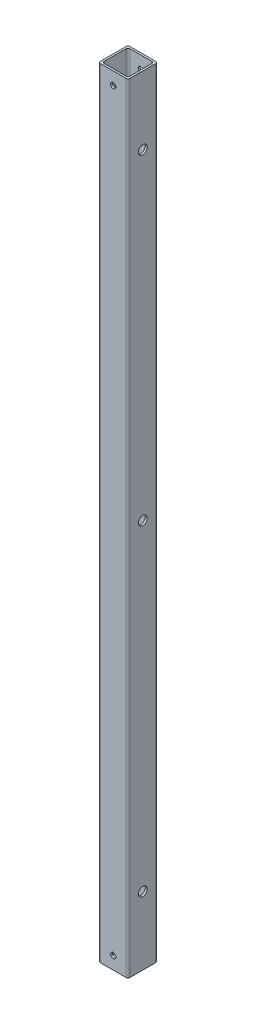
from build123d import *

# Parameters (mm, degrees)
SKETCH1_W                  = 19.304
SKETCH1_H                  = 19.304
SKETCH1_W_2                = 16.764
SKETCH1_H_2                = 16.764
BOSS_EXTRUDE1_DEPTH        = 508
FILLET1_R                  = 1.27
F_1_0_228_DIAMETER_HOLE2_D = 5.7912
F_8_32_TAPPED_HOLE1_D      = 3.4544


with BuildPart() as part:
    # Sketch1 → Boss-Extrude1 (new body)
    with BuildSketch(Plane(origin=(0, 0, 0), x_dir=(1, 0, 0), z_dir=(0, 1, 0))):
        Rectangle(SKETCH1_W, SKETCH1_H)
        Rectangle(SKETCH1_W_2, SKETCH1_H_2, mode=Mode.SUBTRACT)
    extrude(amount=BOSS_EXTRUDE1_DEPTH)

    # Fillet1
    fillet1_edges = [part.edges().sort_by_distance(p)[0] for p in [
        (-8.382, 254, 8.382),
        (8.382, 254, 8.382),
        (8.382, 254, -8.382),
        (-8.382, 254, -8.382),
        (9.652, 254, 9.652),
        (-9.652, 254, 9.652),
        (-9.652, 254, -9.652),
        (9.652, 254, -9.652),
    ]]
    fillet(fillet1_edges, radius=FILLET1_R)

    # #1 (0.228) Diameter Hole2 (through all)
    with Locations(Plane.ZY.offset(9.652)):
        with Locations((0, 463.55), (0, 44.45), (0, 254)):
            Hole(F_1_0_228_DIAMETER_HOLE2_D / 2)

    # #8-32 Tapped Hole1 (through all)
    with Locations(Plane.XY.offset(9.652)):
        with Locations((0, 499.745), (0, 8.255)):
            Hole(F_8_32_TAPPED_HOLE1_D / 2)


solid = part.part
